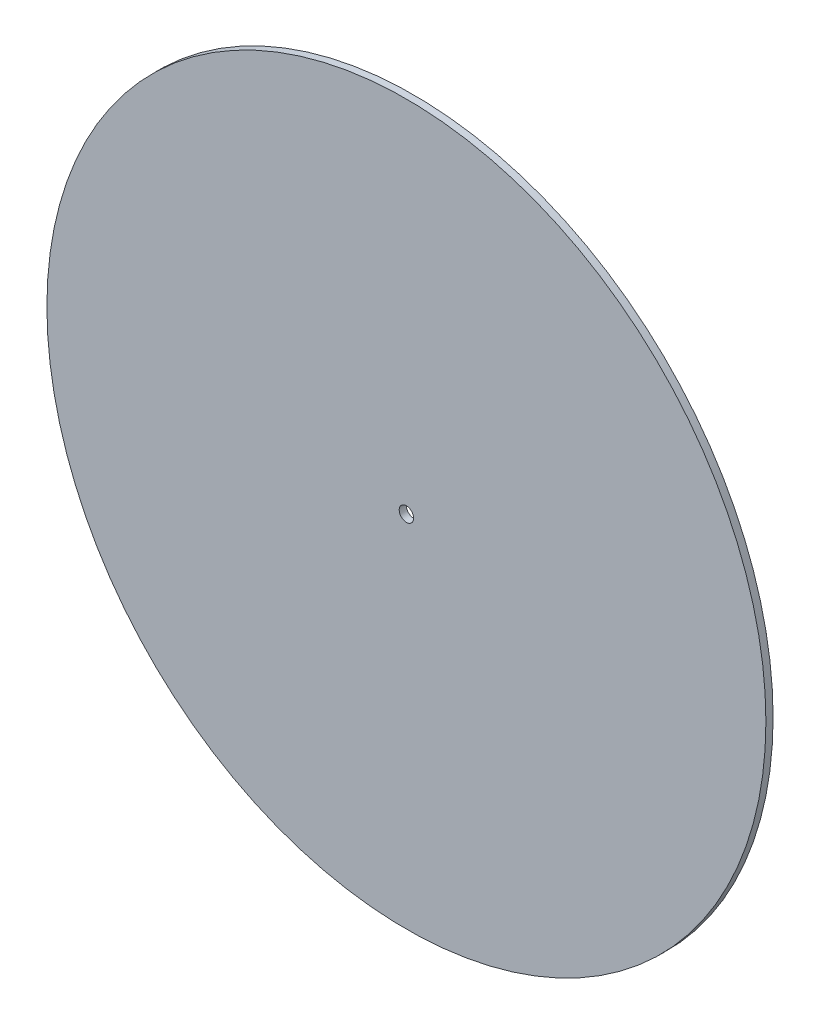
from build123d import *

# Parameters (mm, degrees)
SKETCH1_R           = 100
SKETCH1_R_2         = 2
BOSS_EXTRUDE1_DEPTH = 2


with BuildPart() as part:
    # Sketch1 → Boss-Extrude1 (new body)
    with BuildSketch(Plane.XY):
        Circle(SKETCH1_R)
        Circle(SKETCH1_R_2, mode=Mode.SUBTRACT)
    extrude(amount=BOSS_EXTRUDE1_DEPTH)


solid = part.part
